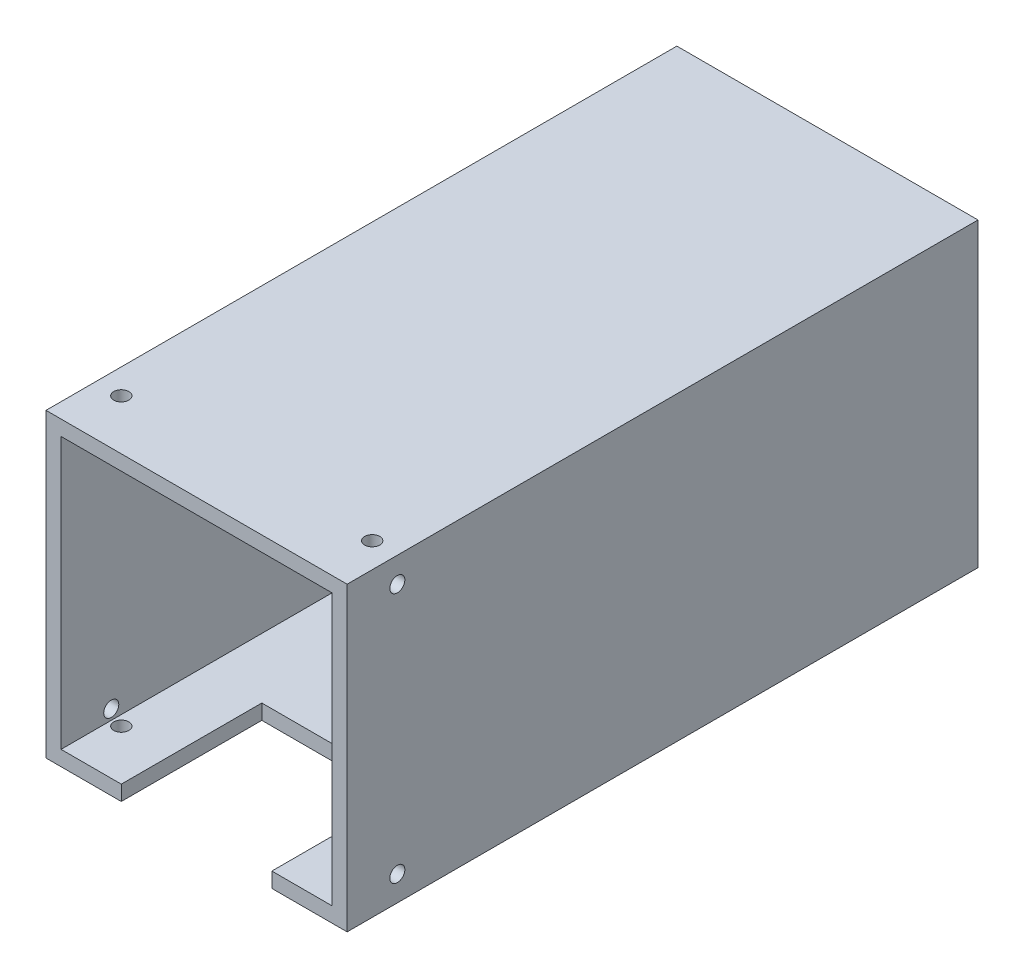
from build123d import *

# Parameters (mm, degrees)
SKETCH1_W           = 60
SKETCH1_H           = 60
SKETCH1_R           = 9
SKETCH1_R_2         = 1.5
BOSS_EXTRUDE1_DEPTH = 4
SKETCH4_R           = 3.2
SKETCH4_R_2         = 2.7
BOSS_EXTRUDE6_DEPTH = 34
SKETCH5_W           = 60
SKETCH5_H           = 60
SKETCH5_W_2         = 54
SKETCH5_H_2         = 54
BOSS_EXTRUDE7_DEPTH = 121.7
SKETCH7_W           = 30
SKETCH7_H           = 28
CUT_EXTRUDE1_DEPTH  = 30.7
SKETCH15_R          = 1.5
CUT_EXTRUDE8_DEPTH  = 82
SKETCH17_W          = 54
SKETCH17_H          = 54
CUT_EXTRUDE9_DEPTH  = 38
SKETCH19_R          = 1.5
CUT_EXTRUDE10_DEPTH = 84
SKETCH20_W          = 15
SKETCH20_H          = 15
SKETCH20_R          = 1.5
BOSS_EXTRUDE8_DEPTH = 5


with BuildPart() as part:
    # Sketch1 → Boss-Extrude1 (new body)
    with BuildSketch(Plane.XY):
        with Locations((-9.011180766, -6.125993037)):
            Rectangle(SKETCH1_W, SKETCH1_H)
        with Locations((-9.011180766, -6.125993037)):
            Circle(SKETCH1_R, mode=Mode.SUBTRACT)
        with Locations((-17.995470725, 2.892105033)):
            Circle(SKETCH1_R_2, mode=Mode.SUBTRACT)
        with Locations((-18.051854011, -15.107894967)):
            Circle(SKETCH1_R_2, mode=Mode.SUBTRACT)
        with Locations((0.004529275, 2.892105033)):
            Circle(SKETCH1_R_2, mode=Mode.SUBTRACT)
        with Locations((-0.051854011, -15.107894967)):
            Circle(SKETCH1_R_2, mode=Mode.SUBTRACT)
    extrude(amount=BOSS_EXTRUDE1_DEPTH)

    # Sketch4 → Boss-Extrude6 (add)
    # profile 1 of 3: a face of its own
    with BuildSketch(Plane(origin=(0, 0, 0), x_dir=(-1, 0, 0), z_dir=(0, 0, -1))):
        with Locations(Location((-5.803539584, 2.84752695, 0), (0, 0, 180))):
            Circle(SKETCH4_R)
        with Locations((-5.803539584, 2.84752695)):
            Circle(SKETCH4_R_2, mode=Mode.SUBTRACT)
    # profile 2 of 3: a face of its own
    with BuildSketch(Plane(origin=(0, 0, 0), x_dir=(-1, 0, 0), z_dir=(0, 0, -1))):
        with Locations(Location((24.189837211, 2.217171142, 0), (0, 0, 180))):
            Circle(SKETCH4_R)
        with Locations((24.189837211, 2.217171142)):
            Circle(SKETCH4_R_2, mode=Mode.SUBTRACT)
    # profile 3 of 3: a face of its own
    with BuildSketch(Plane(origin=(0, 0, 0), x_dir=(-1, 0, 0), z_dir=(0, 0, -1))):
        with Locations(Location((8.64724467, -23.442677204, 0), (0, 0, 180))):
            Circle(SKETCH4_R)
        with Locations((8.64724467, -23.442677204)):
            Circle(SKETCH4_R_2, mode=Mode.SUBTRACT)
    extrude(amount=BOSS_EXTRUDE6_DEPTH)

    # Sketch5 → Boss-Extrude7 (add)
    with BuildSketch(Plane.XY.offset(4)):
        with Locations((-9.011180766, -6.125993037)):
            Rectangle(SKETCH5_W, SKETCH5_H)
        with Locations((-9.011180766, -6.125993037)):
            Rectangle(SKETCH5_W_2, SKETCH5_H_2, mode=Mode.SUBTRACT)
    extrude(amount=BOSS_EXTRUDE7_DEPTH)

    # Sketch7 → Cut-Extrude1 (cut)
    with BuildSketch(Plane.XZ.offset(36.125993037)):
        with Locations((-9.011180766, 111.7)):
            Rectangle(SKETCH7_W, SKETCH7_H)
    extrude(amount=-CUT_EXTRUDE1_DEPTH, mode=Mode.SUBTRACT)

    # Sketch15 → Cut-Extrude8 (cut)
    with BuildSketch(Plane.XZ.offset(36.125993037)):
        with Locations(Location((-34.011180766, 115.7, 0), (0, 0, 270))):
            Circle(SKETCH15_R)
        with Locations(Location((15.988819234, 115.7, 0), (0, 0, 270))):
            Circle(SKETCH15_R)
    extrude(amount=-CUT_EXTRUDE8_DEPTH, mode=Mode.SUBTRACT)

    # Sketch17 → Cut-Extrude9 (cut)
    with BuildSketch(Plane.XY.offset(4)):
        with Locations((-9.011180766, -6.125993037)):
            Rectangle(SKETCH17_W, SKETCH17_H)
    extrude(amount=-CUT_EXTRUDE9_DEPTH, mode=Mode.SUBTRACT)

    # Sketch19 → Cut-Extrude10 (cut)
    with BuildSketch(Plane.ZY.offset(39.011180766)):
        with Locations(Location((115.7, 18.874006963, 0), (0, 0, 270))):
            Circle(SKETCH19_R)
        with Locations(Location((115.7, -31.125993037, 0), (0, 0, 270))):
            Circle(SKETCH19_R)
    extrude(amount=-CUT_EXTRUDE10_DEPTH, mode=Mode.SUBTRACT)

    # Sketch20 → Boss-Extrude8 (add)
    # profile 1 of 4: a face of its own
    with BuildSketch(Plane(origin=(0, 0, 0), x_dir=(-1, 0, 0), z_dir=(0, 0, -1))):
        with Locations((-13.488819234, -28.625993037)):
            Rectangle(SKETCH20_W, SKETCH20_H)
        with Locations((-13.488819234, -28.625993037)):
            Circle(SKETCH20_R, mode=Mode.SUBTRACT)
    # profile 2 of 4: a face of its own
    with BuildSketch(Plane(origin=(0, 0, 0), x_dir=(-1, 0, 0), z_dir=(0, 0, -1))):
        with Locations((31.511180766, -28.625993037)):
            Rectangle(SKETCH20_W, SKETCH20_H)
        with Locations((31.511180766, -28.625993037)):
            Circle(SKETCH20_R, mode=Mode.SUBTRACT)
    # profile 3 of 4: a face of its own
    with BuildSketch(Plane(origin=(0, 0, 0), x_dir=(-1, 0, 0), z_dir=(0, 0, -1))):
        with Locations((31.511180766, 16.374006963)):
            Rectangle(SKETCH20_W, SKETCH20_H)
        with Locations((31.511180766, 16.374006963)):
            Circle(SKETCH20_R, mode=Mode.SUBTRACT)
    # profile 4 of 4: a face of its own
    with BuildSketch(Plane(origin=(0, 0, 0), x_dir=(-1, 0, 0), z_dir=(0, 0, -1))):
        with Locations((-13.488819234, 16.374006963)):
            Rectangle(SKETCH20_W, SKETCH20_H)
        with Locations((-13.488819234, 16.374006963)):
            Circle(SKETCH20_R, mode=Mode.SUBTRACT)
    extrude(amount=-BOSS_EXTRUDE8_DEPTH)


solid = part.part
